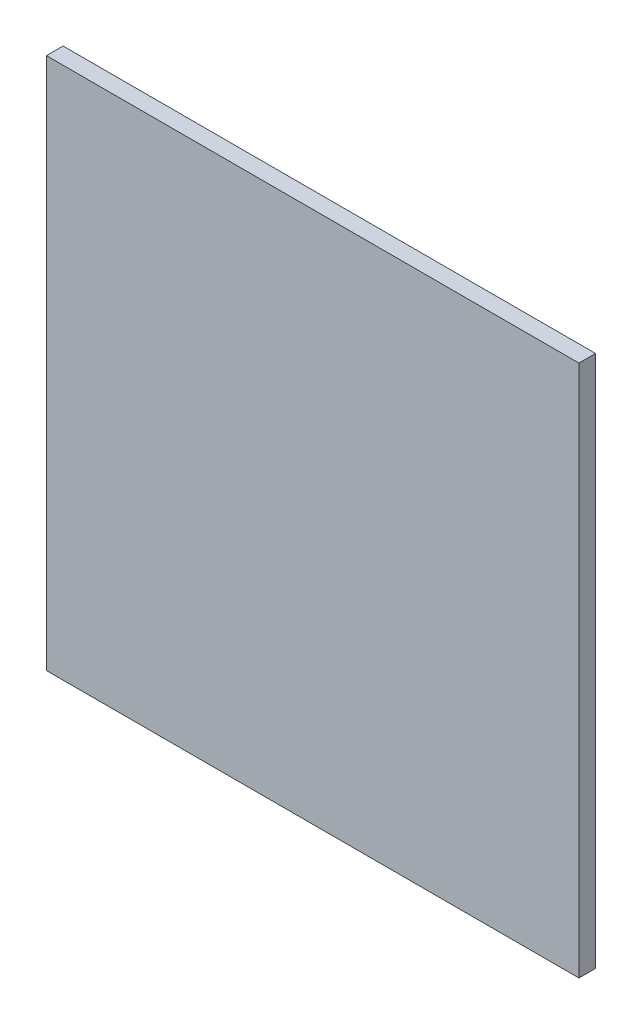
from build123d import *

# Parameters (mm, degrees)
CROQUIS1_W              = 320
CROQUIS1_H              = 320
SALIENTE_EXTRUIR2_DEPTH = 10
CROQUIS2_W              = 160
CROQUIS2_H              = 160
SALIENTE_EXTRUIR3_DEPTH = 58
CROQUIS3_R              = 19
CORTAR_EXTRUIR1_DEPTH   = 58
CROQUIS6_W              = 140
CROQUIS6_H              = 140
CROQUIS6_R              = 35
CORTAR_EXTRUIR5_DEPTH   = 60
CROQUIS7_W              = 20
CROQUIS7_H              = 10
CORTAR_EXTRUIR6_DEPTH   = 69


with BuildPart() as part:
    # Croquis1 → Saliente-Extruir2 (new body)
    with BuildSketch(Plane.XY):
        with Locations((-50, -50)):
            Rectangle(CROQUIS1_W, CROQUIS1_H)
    extrude(amount=SALIENTE_EXTRUIR2_DEPTH)

    # Croquis2 → Saliente-Extruir3 (add)
    with BuildSketch(Plane.XY):
        with Locations((-50, -50)):
            Rectangle(CROQUIS2_W, CROQUIS2_H)
    extrude(amount=-SALIENTE_EXTRUIR3_DEPTH)

    # Croquis3 → Cortar-Extruir1 (cut)
    with BuildSketch(Plane(origin=(0, 0, -58), x_dir=(-1, 0, 0), z_dir=(0, 0, -1))):
        with Locations((50, -50)):
            Circle(CROQUIS3_R)
    extrude(amount=-CORTAR_EXTRUIR1_DEPTH, mode=Mode.SUBTRACT)

    # Croquis6 → Cortar-Extruir5 (cut)
    with BuildSketch(Plane(origin=(0, 0, -58), x_dir=(-1, 0, 0), z_dir=(0, 0, -1))):
        with Locations((50, -50)):
            Rectangle(CROQUIS6_W, CROQUIS6_H)
        with Locations((50, -50)):
            Circle(CROQUIS6_R, mode=Mode.SUBTRACT)
    extrude(amount=-CORTAR_EXTRUIR5_DEPTH, mode=Mode.SUBTRACT)

    # Croquis7 → Cortar-Extruir6 (cut)
    with BuildSketch(Plane.XZ.offset(130)):
        with Locations((-50, -5)):
            Rectangle(CROQUIS7_W, CROQUIS7_H)
    extrude(amount=-CORTAR_EXTRUIR6_DEPTH, mode=Mode.SUBTRACT)


solid = part.part
